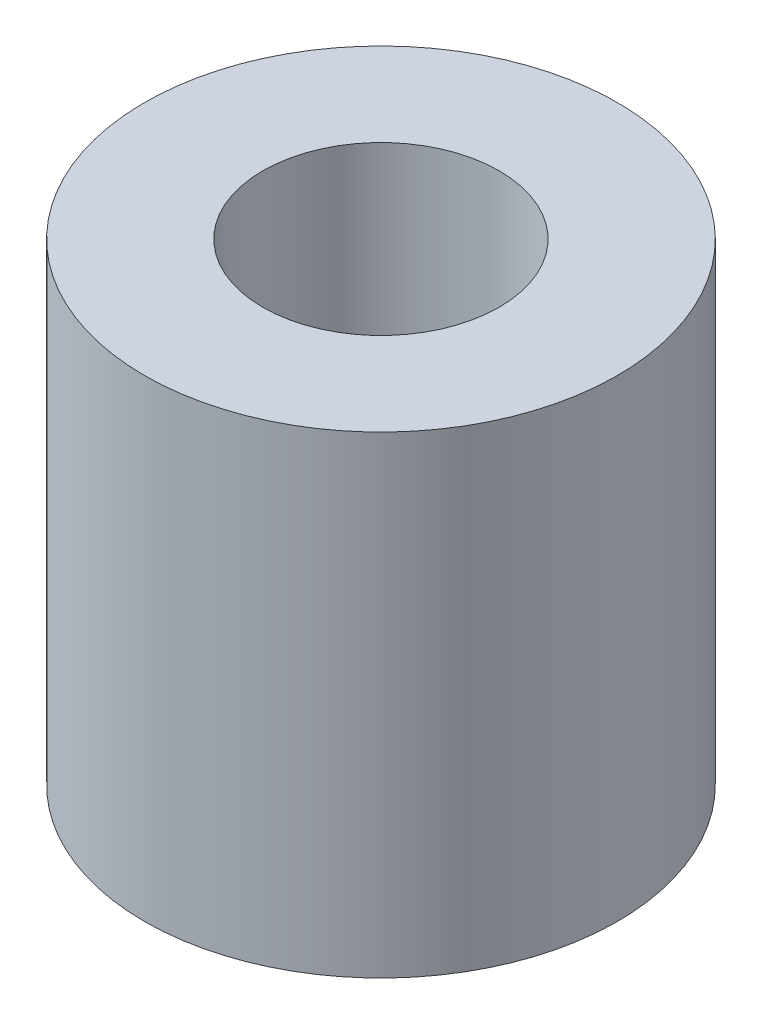
from build123d import *

# Parameters (mm, degrees)
SKETCH1_R           = 6.35
SKETCH1_R_2         = 3.175
BOSS_EXTRUDE1_DEPTH = 12.7


with BuildPart() as part:
    # Sketch1 → Boss-Extrude1 (new body)
    with BuildSketch(Plane(origin=(0, 0, 0), x_dir=(1, 0, 0), z_dir=(0, 1, 0))):
        with Locations(Location((0, 0, 0), (0, 0, 270))):
            Circle(SKETCH1_R)
        with Locations(Location((0, 0, 0), (0, 0, 270))):
            Circle(SKETCH1_R_2, mode=Mode.SUBTRACT)
    extrude(amount=BOSS_EXTRUDE1_DEPTH)


solid = part.part
